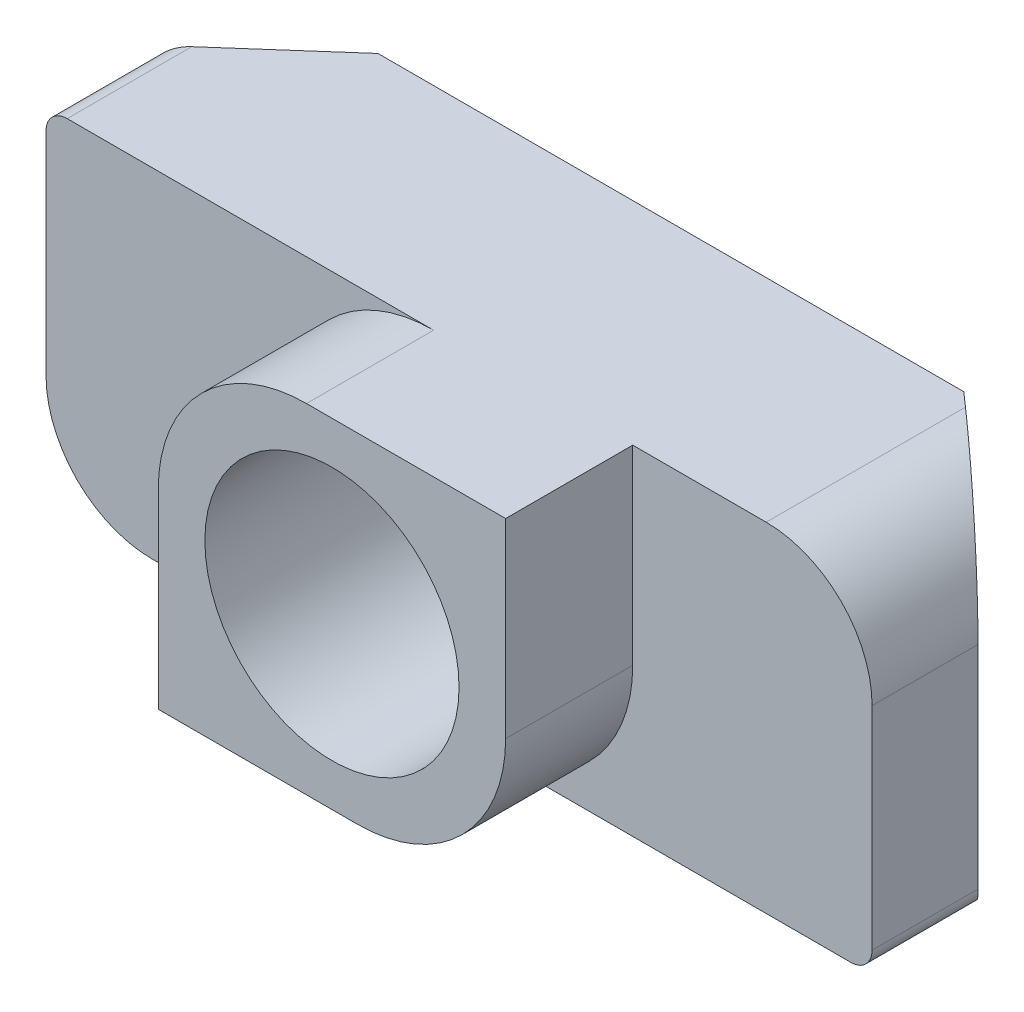
from build123d import *

# Parameters (mm, degrees)
SKETCH_1_W          = 19.5
SKETCH_1_H          = 8
EXTRUDE_1_DEPTH     = 5
FILLET_1_R          = 2.5
FILLET_2_R          = 0.5
CUT_EXTRUDE_2_DEPTH = 14.566963551
SKETCH_3_W          = 8.2
SKETCH_3_H          = 8
EXTRUDE_2_DEPTH     = 3
FILLET_3_R          = 3.5
SKETCH_4_R          = 3
CUT_EXTRUDE_3_DEPTH = 14.231118622


with BuildPart() as part:
    # 草图1 → 凸台-拉伸1 (new body)
    with BuildSketch(Plane.XY):
        Rectangle(SKETCH_1_W, SKETCH_1_H)
    extrude(amount=EXTRUDE_1_DEPTH)

    # 圆角1
    fillet_1_edges = [part.edges().sort_by_distance(p)[0] for p in [
        (-9.75, -4, 2.5),
        (9.75, 4, 2.5),
    ]]
    fillet(fillet_1_edges, radius=FILLET_1_R)

    # 圆角2
    fillet_2_edges = [part.edges().sort_by_distance(p)[0] for p in [
        (9.75, -4, 2.5),
        (-9.75, 4, 2.5),
    ]]
    fillet(fillet_2_edges, radius=FILLET_2_R)

    # 草图2 → 切除-拉伸2 (cut, through all)
    with BuildSketch(Plane.XZ.offset(4)):
        Polygon((-9.75, 2.5), (-6.914115374, 0), (-9.75, 0), align=None)
    cut_extrude_2 = extrude(amount=-CUT_EXTRUDE_2_DEPTH, mode=Mode.SUBTRACT)

    # 镜向1: 切除-拉伸2 across plane
    add(cut_extrude_2.mirror(Plane(origin=(0, 0, 0), x_dir=(0, 0, 1), z_dir=(1, 0, 0))), mode=Mode.SUBTRACT)

    # 草图3 → 凸台-拉伸2 (add)
    with BuildSketch(Plane.XY.offset(5)):
        Rectangle(SKETCH_3_W, SKETCH_3_H)
    extrude(amount=EXTRUDE_2_DEPTH)

    # 圆角3
    fillet_3_edges = [part.edges().sort_by_distance(p)[0] for p in [
        (4.1, -4, 6.5),
        (-4.1, 4, 6.5),
    ]]
    fillet(fillet_3_edges, radius=FILLET_3_R)

    # 草图4 → 切除-拉伸3 (cut, through all)
    with BuildSketch(Plane.XY.offset(8)):
        Circle(SKETCH_4_R)
    extrude(amount=-CUT_EXTRUDE_3_DEPTH, mode=Mode.SUBTRACT)


solid = part.part
